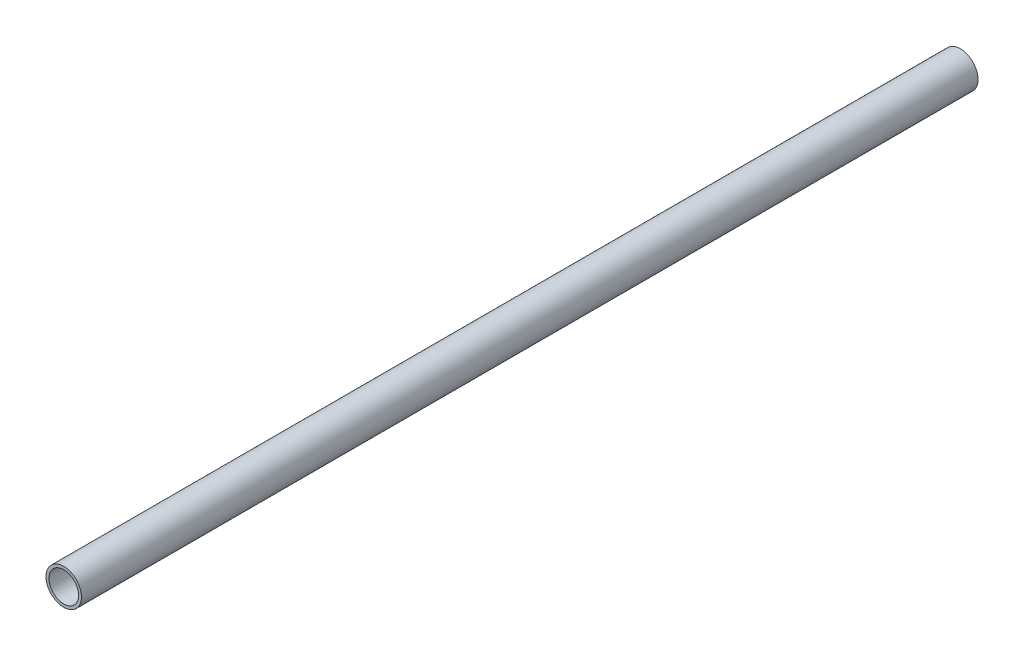
from build123d import *

# Parameters (mm, degrees)
SKETCH1_R           = 24.13
SKETCH1_R_2         = 20.193
BOSS_EXTRUDE1_DEPTH = 1219.2


with BuildPart() as part:
    # Sketch1 → Boss-Extrude1 (new body)
    with BuildSketch(Plane.XY):
        Circle(SKETCH1_R)
        Circle(SKETCH1_R_2, mode=Mode.SUBTRACT)
    extrude(amount=BOSS_EXTRUDE1_DEPTH)


solid = part.part
